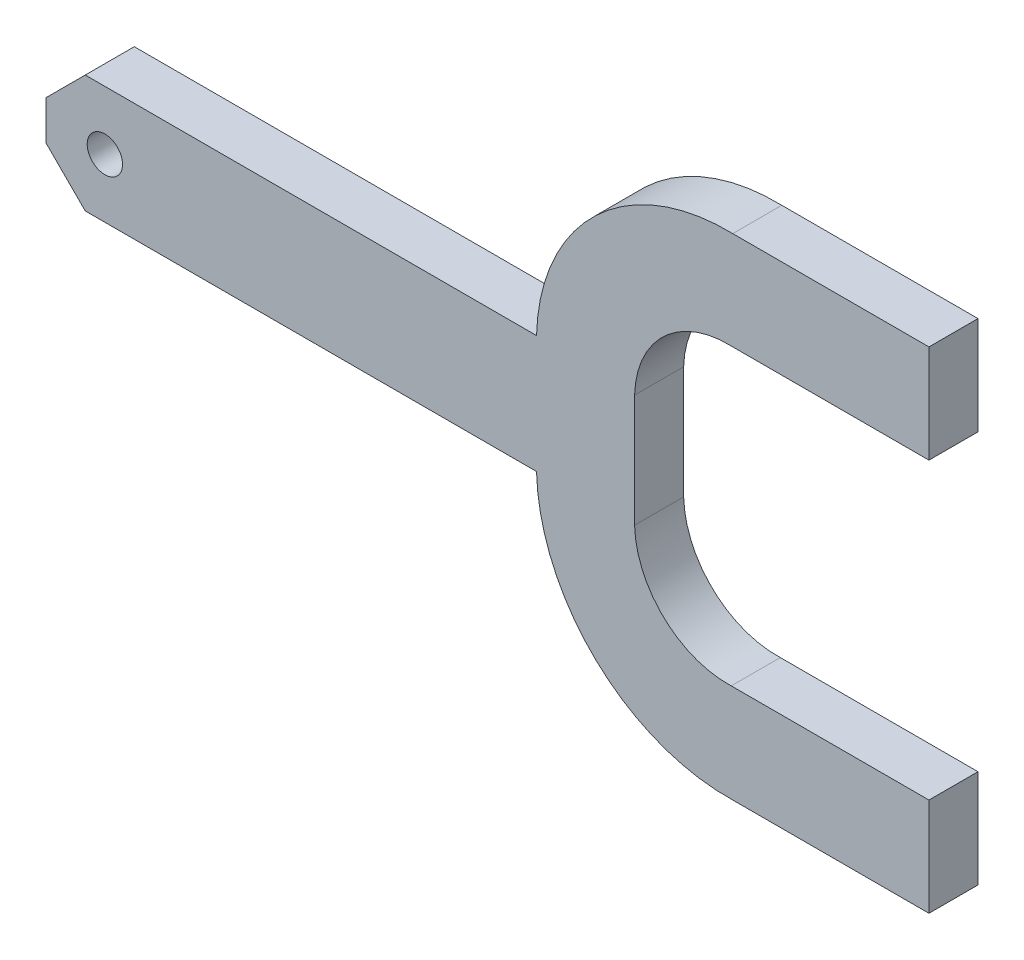
from build123d import *

# Parameters (mm, degrees)
SKETCH1_R           = 1.8
BOSS_EXTRUDE2_DEPTH = 5


with BuildPart() as part:
    # Sketch1 → Boss-Extrude2 (new body)
    with BuildSketch(Plane.XY):
        with BuildLine():
            Line((4, 0), (50, 0))
            ThreePointArc((50, 0), (56.064971157, -13.642135624), (70, -19))
            Line((70, -19), (90, -19))
            Line((90, -19), (90, -9))
            Line((90, -9), (69.8490214, -9))
            ThreePointArc((69.8490214, -9), (62.990773359, -6.428332012), (59.996714309, 0.256326008))
            Line((59.996714309, 0.256326008), (59.996714309, 11.743673992))
            ThreePointArc((59.996714309, 11.743673992), (62.990773359, 18.428332012), (69.8490214, 21))
            Line((69.8490214, 21), (90, 21))
            Line((90, 21), (90, 31))
            Line((90, 31), (70, 31))
            ThreePointArc((70, 31), (56.064971157, 25.642135624), (50, 12))
            Line((50, 12), (4, 12))
            Line((4, 12), (0, 8))
            Line((0, 8), (0, 4))
            Line((0, 4), (4, 0))
        make_face()
        with Locations((6, 6)):
            Circle(SKETCH1_R, mode=Mode.SUBTRACT)
    extrude(amount=BOSS_EXTRUDE2_DEPTH)


solid = part.part
